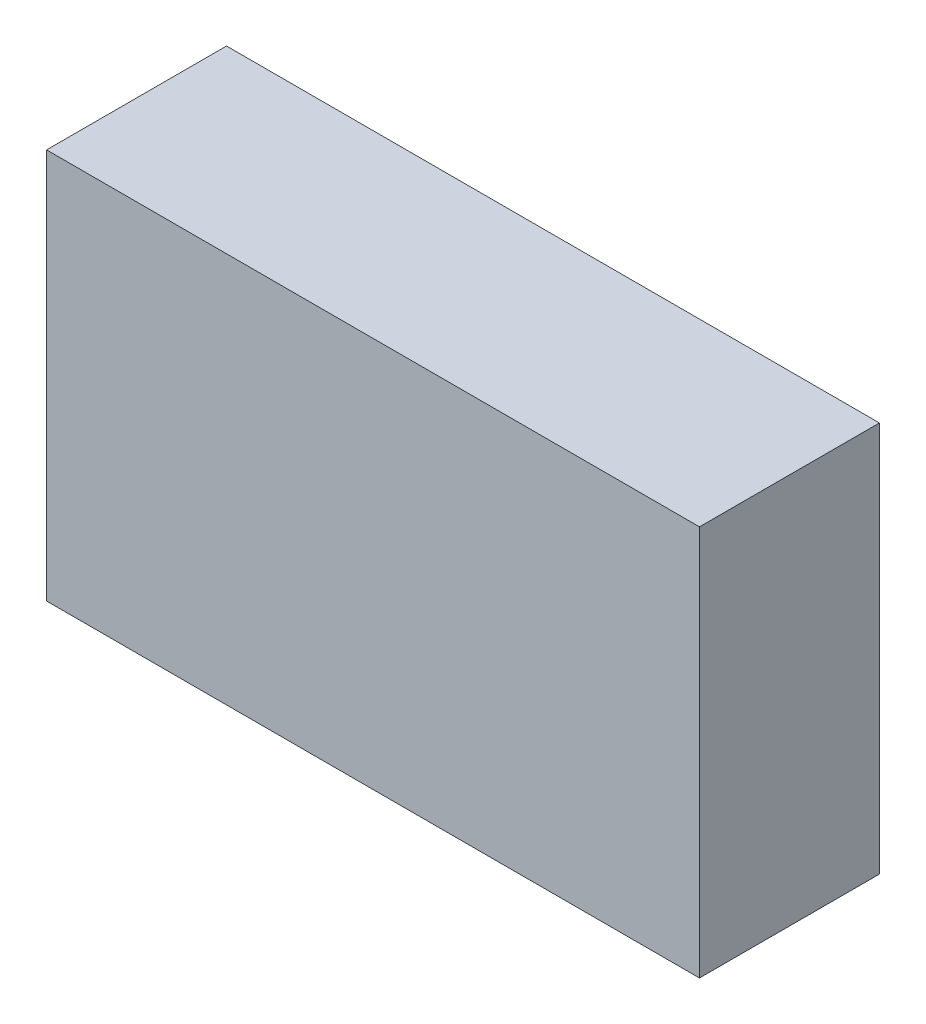
from build123d import *

# Parameters (mm, degrees)
SKETCH1_W           = 127
SKETCH1_H           = 76
BOSS_EXTRUDE1_DEPTH = 35


with BuildPart() as part:
    # Sketch1 → Boss-Extrude1 (new body)
    with BuildSketch(Plane.XY):
        Rectangle(SKETCH1_W, SKETCH1_H)
    extrude(amount=BOSS_EXTRUDE1_DEPTH)


solid = part.part
